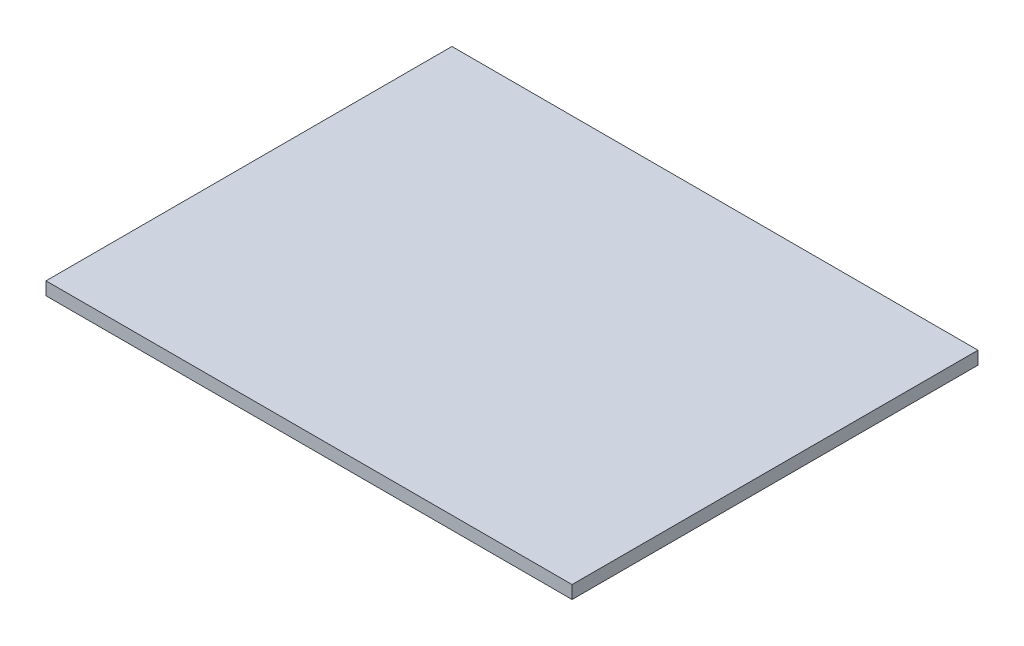
from build123d import *

# Parameters (mm, degrees)
SKETCH_1_W      = 648
SKETCH_1_H      = 500
EXTRUDE_1_DEPTH = 16


with BuildPart() as part:
    # Эскиз1 → Бобышка-Вытянуть1 (new body)
    with BuildSketch(Plane(origin=(0, 0, 0), x_dir=(1, 0, 0), z_dir=(0, 1, 0))):
        with Locations((262.292624827, 205.417401392)):
            Rectangle(SKETCH_1_W, SKETCH_1_H)
    extrude(amount=EXTRUDE_1_DEPTH)


solid = part.part
